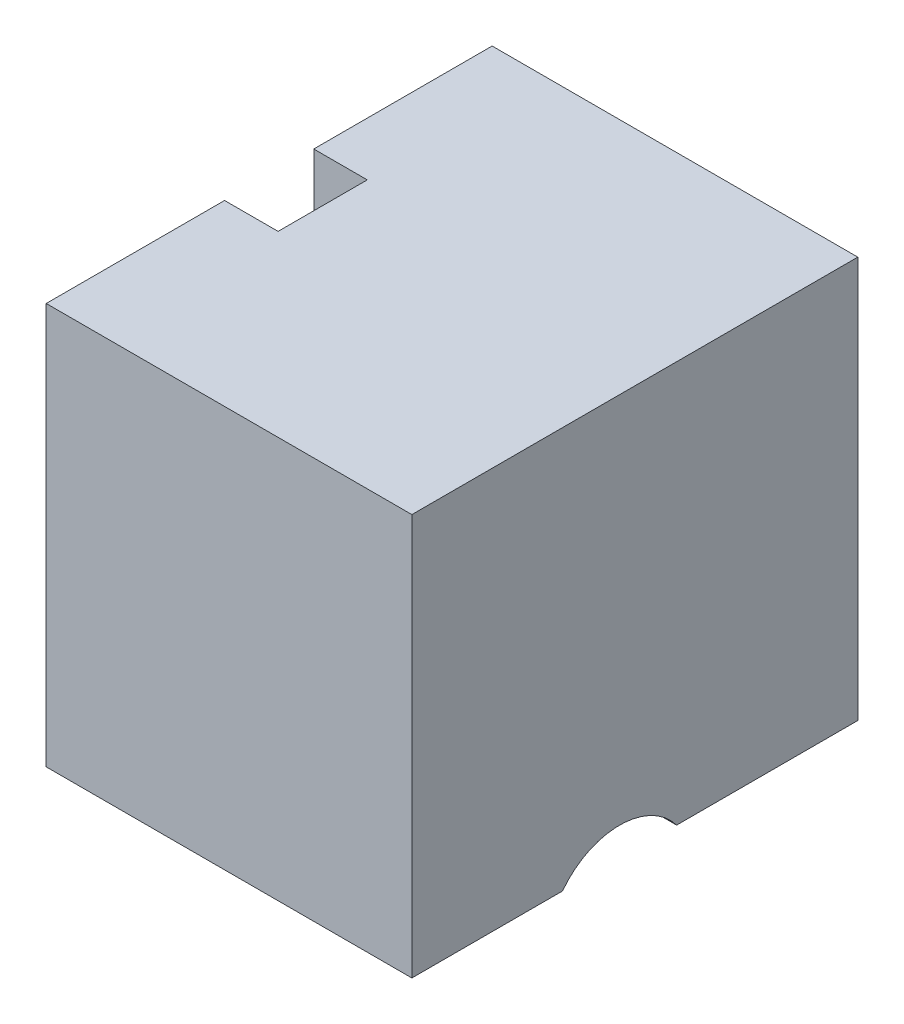
from build123d import *

# Parameters (mm, degrees)
SKETCH1_W               = 41
SKETCH1_H               = 50
BOSS_EXTRUDE1_DEPTH     = 45
CUT_EXTRUDE1_DEPTH      = 59.85373316
CUT_EXTRUDE1_DEPTH_BACK = 10
SKETCH2_W               = 12
SKETCH2_H               = 10
CUT_EXTRUDE2_DEPTH      = 67.47818445
CUT_EXTRUDE2_DEPTH_BACK = 67.47818445
SKETCH3_R               = 8


with BuildPart() as part:
    # Sketch1 → Boss-Extrude1 (new body)
    with BuildSketch(Plane(origin=(0, 0, 0), x_dir=(1, 0, 0), z_dir=(0, 1, 0))):
        with Locations((6.433490288, 1.708594269)):
            Rectangle(SKETCH1_W, SKETCH1_H)
    extrude(amount=BOSS_EXTRUDE1_DEPTH)

    # Sketch2 → Cut-Extrude1 (cut, two sides: drawn at the far end of the back side and taken through both)
    with BuildSketch(Plane(origin=(0, 45, 0), x_dir=(1, 0, 0), z_dir=(0, 1, 0)).offset(-CUT_EXTRUDE1_DEPTH_BACK)):
        with Locations((-14.066509712, 1.708594269)):
            Rectangle(SKETCH2_W, SKETCH2_H)
    extrude(amount=CUT_EXTRUDE1_DEPTH + CUT_EXTRUDE1_DEPTH_BACK, mode=Mode.SUBTRACT)

    # Sketch3 → Cut-Extrude2 (cut, two sides: drawn at the far end of the back side and taken through both)
    with BuildSketch(Plane(origin=(26.933490288, 0, 0), x_dir=(0, 0, -1), z_dir=(1, 0, 0)).offset(-CUT_EXTRUDE2_DEPTH_BACK)):
        with Locations((0, -4.804588256)):
            Circle(SKETCH3_R)
    extrude(amount=CUT_EXTRUDE2_DEPTH + CUT_EXTRUDE2_DEPTH_BACK, mode=Mode.SUBTRACT)


solid = part.part
